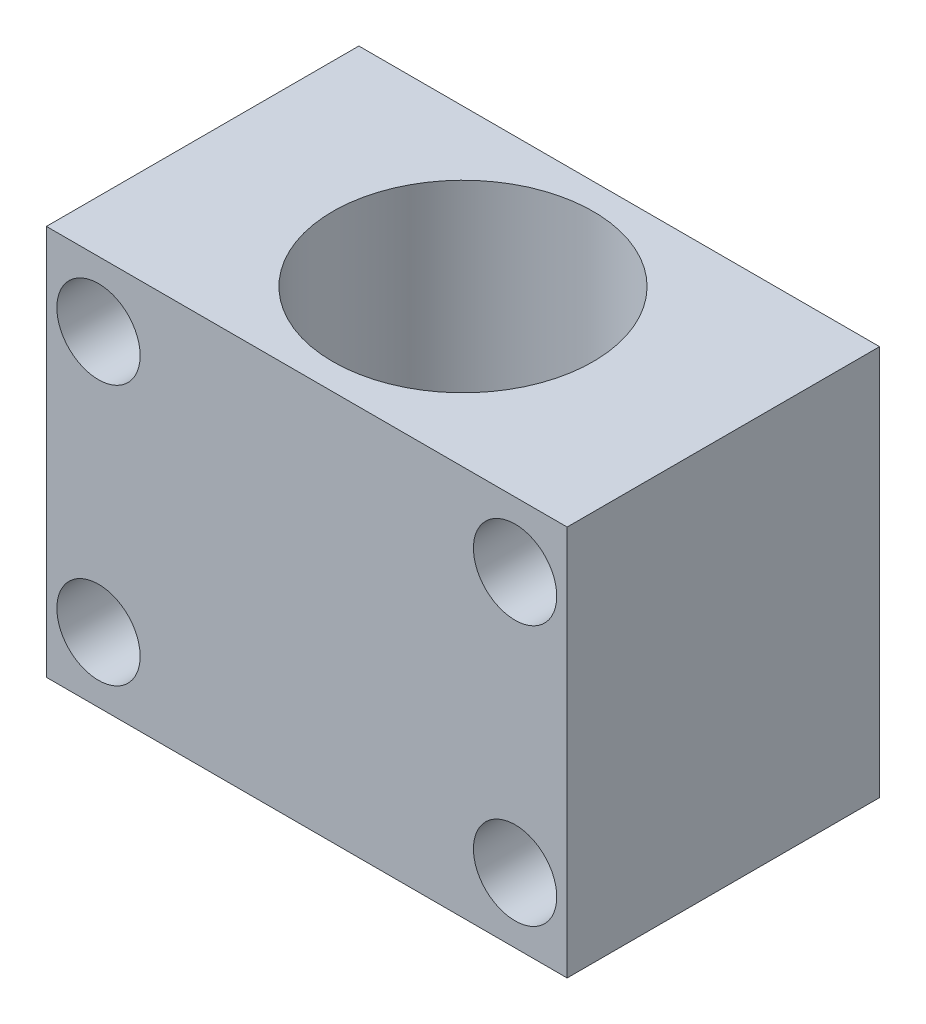
from build123d import *

# Parameters (mm, degrees)
SZKIC1_W                    = 20
SZKIC1_H                    = 12
SZKIC1_R                    = 5
DODANIE_WYCI_GNI_CIE1_DEPTH = 15
OTW_R_3_2_3_2_1_D           = 3.2


with BuildPart() as part:
    # Szkic1 → Dodanie-wyciągnięcie1 (new body)
    with BuildSketch(Plane(origin=(0, 0, 0), x_dir=(1, 0, 0), z_dir=(0, 1, 0))):
        Rectangle(SZKIC1_W, SZKIC1_H)
        with Locations(Location((0, 0, 0), (0, 0, 270))):
            Circle(SZKIC1_R, mode=Mode.SUBTRACT)
    extrude(amount=DODANIE_WYCI_GNI_CIE1_DEPTH)

    # Otwór Ø3.2 (3.2)1 (through all)
    with Locations(Plane.XY.offset(6)):
        with Locations((8, 12.5), (-8, 12.5), (-8, 2.5), (8, 2.5)):
            Hole(OTW_R_3_2_3_2_1_D / 2)


solid = part.part
